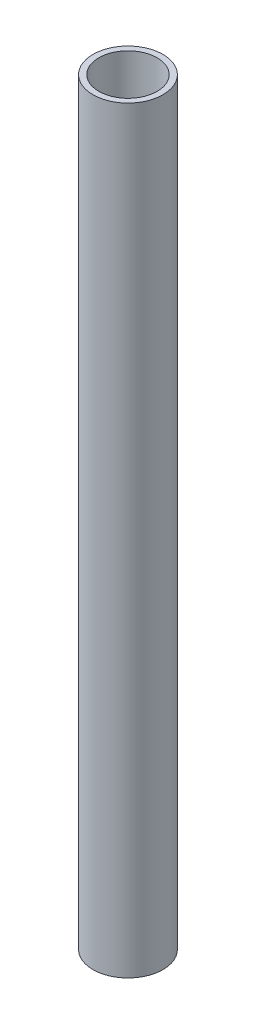
from build123d import *

# Parameters (mm, degrees)
SKETCH_1_R      = 6
SKETCH_1_R_2    = 5
EXTRUDE_1_DEPTH = 130


with BuildPart() as part:
    # 草图1 → 拉伸-薄壁1 (new body)
    with BuildSketch(Plane(origin=(0, 0, 0), x_dir=(1, 0, 0), z_dir=(0, 1, 0))):
        Circle(SKETCH_1_R)
        Circle(SKETCH_1_R_2, mode=Mode.SUBTRACT)
    extrude(amount=EXTRUDE_1_DEPTH)


solid = part.part
